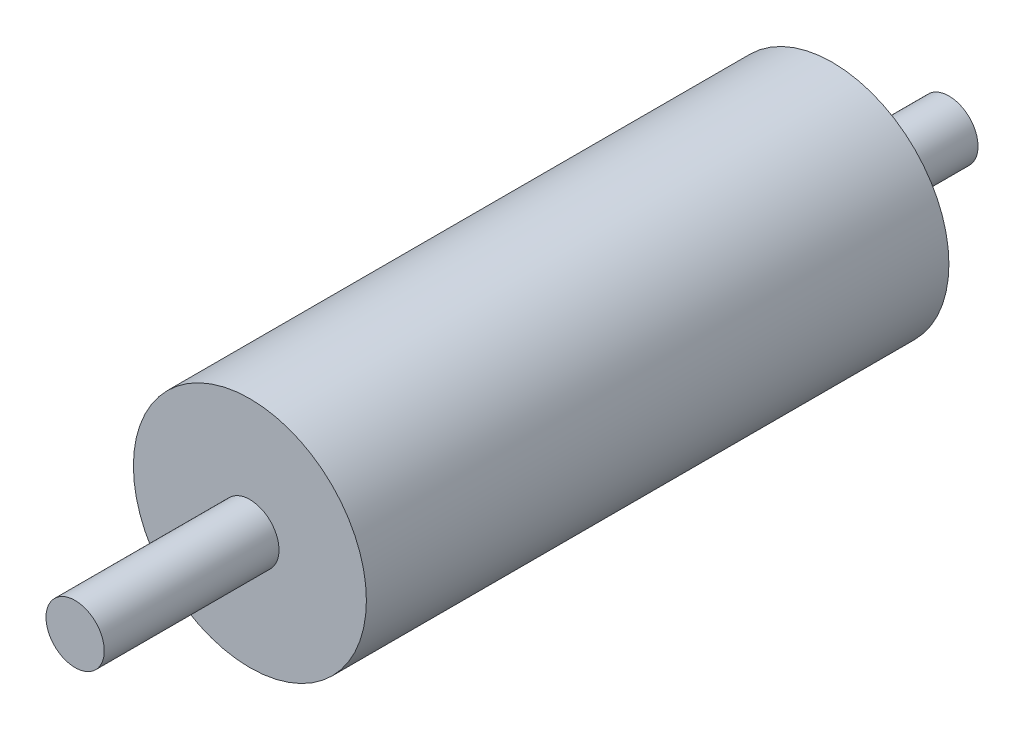
from build123d import *

# Parameters (mm, degrees)
SKETCH1_R           = 20
BOSS_EXTRUDE1_DEPTH = 100
SKETCH2_R           = 5
BOSS_EXTRUDE2_DEPTH = 30
LPATTERN1_COUNT     = 2
LPATTERN1_PITCH     = 130
SKETCH3_R           = 7.5
CUT_EXTRUDE1_DEPTH  = 10


with BuildPart() as part:
    # Sketch1 → Boss-Extrude1 (new body)
    with BuildSketch(Plane.XY):
        Circle(SKETCH1_R)
    extrude(amount=BOSS_EXTRUDE1_DEPTH)

    # Sketch2 → Boss-Extrude2 (add)
    with BuildSketch(Plane.XY.offset(100)):
        with Locations(Location((0, 0, 0), (0, 0, 180))):
            Circle(SKETCH2_R)
    boss_extrude2 = extrude(amount=BOSS_EXTRUDE2_DEPTH)

    # LPattern1: Boss-Extrude2 ×2
    with Locations(*[(0, 0, -i * LPATTERN1_PITCH) for i in range(1, LPATTERN1_COUNT)]):
        add(boss_extrude2)

    # Sketch3 → Cut-Extrude1 (cut)
    with BuildSketch(Plane(origin=(0, 0, -30), x_dir=(-1, 0, 0), z_dir=(0, 0, -1))):
        Circle(SKETCH3_R)
    extrude(amount=-CUT_EXTRUDE1_DEPTH, mode=Mode.SUBTRACT)


solid = part.part
